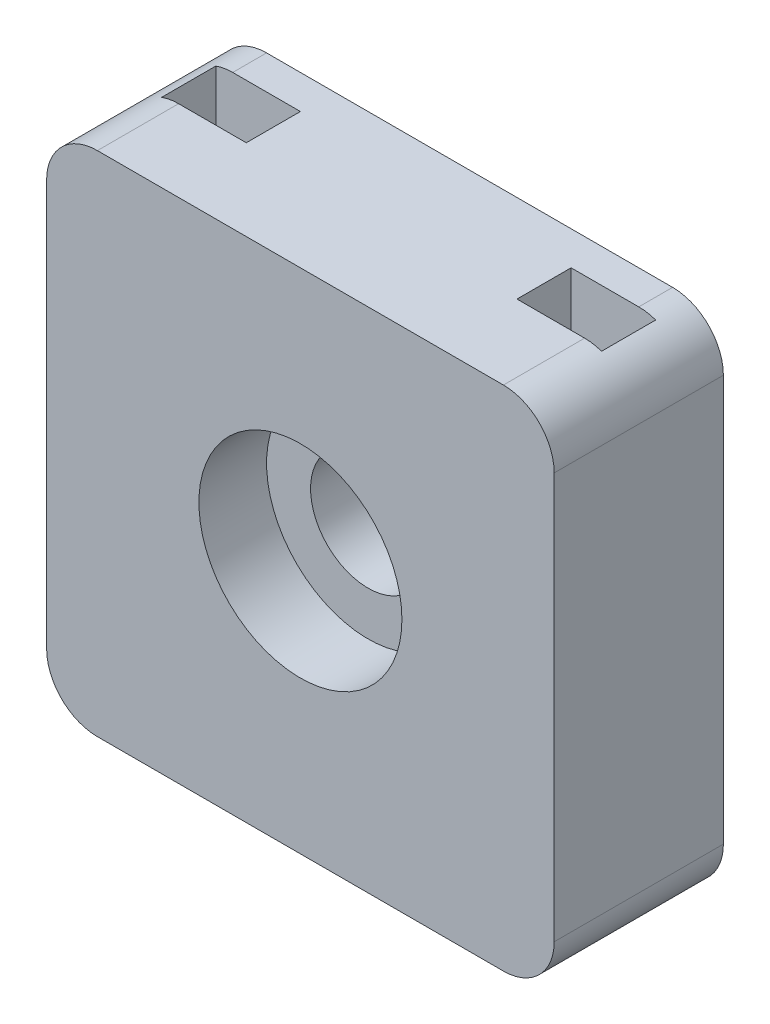
from build123d import *

# Parameters (mm, degrees)
BASE_15X15_DEPTH     = 5
CROQUIS2_R           = 1.7
PASO_M3_DEPTH        = 5
CAJA_CABEZA_START    = 3
CROQUIS3_R           = 3
CAJA_CABEZA_DEPTH    = 2
TUNEL_CINCHO_A_START = 4
CROQUIS4_W           = 1.6
CROQUIS4_H           = 16
TUNEL_CINCHO_A_DEPTH = 2.5
TUNEL_CINCHO_B_START = -6.5
CROQUIS5_W           = 1.6
CROQUIS5_H           = 16
TUNEL_CINCHO_B_DEPTH = 2.5


with BuildPart() as part:
    # Croquis1 → Base_15x15 (new body)
    with BuildSketch(Plane.XY):
        with BuildLine():
            Line((-6, -7.5), (6, -7.5))
            ThreePointArc((6, -7.5), (7.060660172, -7.060660172), (7.5, -6))
            Line((7.5, -6), (7.5, 6))
            ThreePointArc((7.5, 6), (7.060660172, 7.060660172), (6, 7.5))
            Line((6, 7.5), (-6, 7.5))
            ThreePointArc((-6, 7.5), (-7.060660172, 7.060660172), (-7.5, 6))
            Line((-7.5, 6), (-7.5, -6))
            ThreePointArc((-7.5, -6), (-7.060660172, -7.060660172), (-6, -7.5))
        make_face()
    extrude(amount=BASE_15X15_DEPTH)

    # Croquis2 → Paso_M3 (cut)
    with BuildSketch(Plane.XY):
        Circle(CROQUIS2_R)
    extrude(amount=PASO_M3_DEPTH, mode=Mode.SUBTRACT)

    # Croquis3 → Caja_cabeza (cut)
    with BuildSketch(Plane.XY.offset(CAJA_CABEZA_START)):
        Circle(CROQUIS3_R)
    extrude(amount=CAJA_CABEZA_DEPTH, mode=Mode.SUBTRACT)

    # Croquis4 → Tunel_cincho_A (cut)
    with BuildSketch(Plane(origin=(0, 0, 0), x_dir=(0, 0, -1), z_dir=(1, 0, 0)).offset(TUNEL_CINCHO_A_START)):
        with Locations((-1.8, 0)):
            Rectangle(CROQUIS4_W, CROQUIS4_H)
    extrude(amount=TUNEL_CINCHO_A_DEPTH, mode=Mode.SUBTRACT)

    # Croquis5 → Tunel_cincho_B (cut)
    with BuildSketch(Plane(origin=(0, 0, 0), x_dir=(0, 0, -1), z_dir=(1, 0, 0)).offset(TUNEL_CINCHO_B_START)):
        with Locations((-1.8, 0)):
            Rectangle(CROQUIS5_W, CROQUIS5_H)
    extrude(amount=TUNEL_CINCHO_B_DEPTH, mode=Mode.SUBTRACT)


solid = part.part
